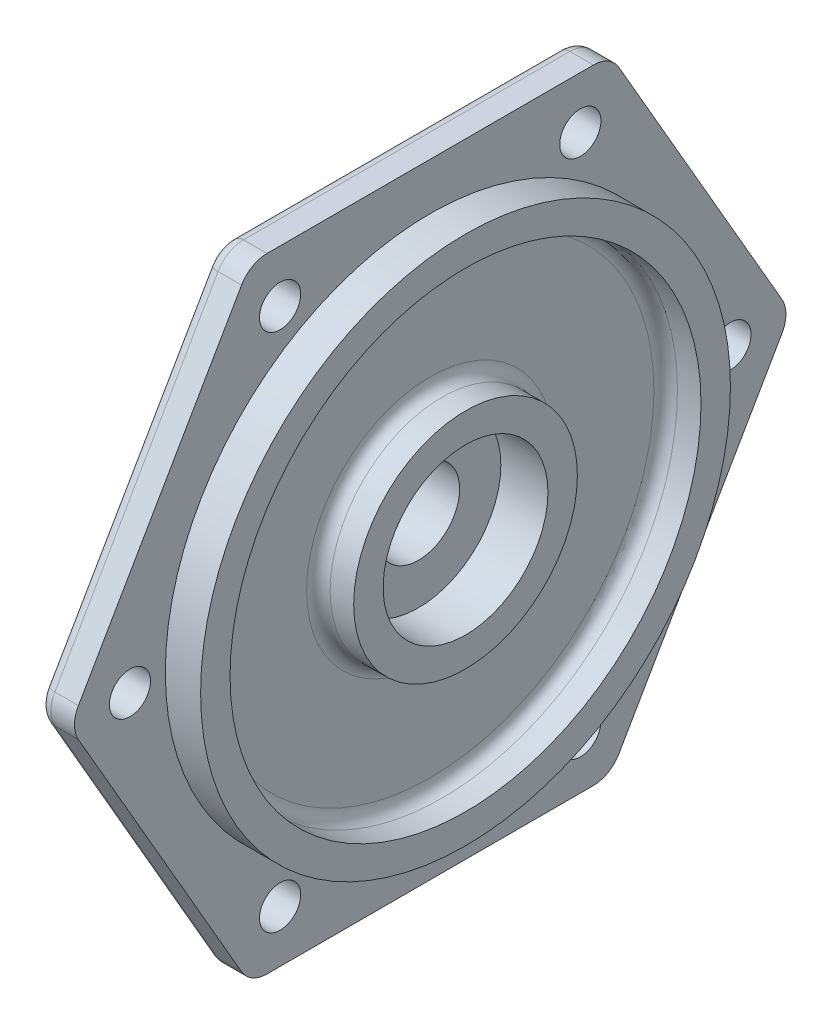
from build123d import *

# Parameters (mm, degrees)
SKETCH1_R               = 3.5
BOSS_EXTRUDE1_DEPTH     = 6
FILLET1_R               = 2
SKETCH2_R               = 45
SKETCH2_R_2             = 40
BOSS_EXTRUDE2_DEPTH     = 6
FILLET2_R               = 2
SKETCH3_R               = 19
SKETCH3_R_2             = 14
BOSS_EXTRUDE3_DEPTH     = 6
FILLET3_R               = 2
CUT_EXTRUDE1_START      = -2
SKETCH4_R               = 14
CUT_EXTRUDE1_DEPTH      = 2
SKETCH6_R               = 23
BOSS_EXTRUDE4_DEPTH     = 4
CUT_EXTRUDE2_DEPTH      = 81.772868331
CUT_EXTRUDE2_DEPTH_BACK = 81.772868331
SKETCH7_R               = 7


with BuildPart() as part:
    # Sketch1 → Boss-Extrude1 (new body)
    with BuildSketch(Plane(origin=(0, 0, 0), x_dir=(0, 0, -1), z_dir=(1, 0, 0))):
        with BuildLine():
            Line((59.755752861, 2.5), (32.04293994, 50.5))
            ThreePointArc((32.04293994, 50.5), (30.212812921, 52.330127019), (27.712812921, 53))
            Line((27.712812921, 53), (-27.712812921, 53))
            ThreePointArc((-27.712812921, 53), (-30.212812921, 52.330127019), (-32.04293994, 50.5))
            Line((-32.04293994, 50.5), (-59.755752861, 2.5))
            ThreePointArc((-59.755752861, 2.5), (-60.425625842, 0), (-59.755752861, -2.5))
            Line((-59.755752861, -2.5), (-32.04293994, -50.5))
            ThreePointArc((-32.04293994, -50.5), (-30.212812921, -52.330127019), (-27.712812921, -53))
            Line((-27.712812921, -53), (27.712812921, -53))
            ThreePointArc((27.712812921, -53), (30.212812921, -52.330127019), (32.04293994, -50.5))
            Line((32.04293994, -50.5), (59.755752861, -2.5))
            ThreePointArc((59.755752861, -2.5), (60.425625842, 0), (59.755752861, 2.5))
        make_face()
        with Locations((-51, 0)):
            Circle(SKETCH1_R, mode=Mode.SUBTRACT)
        with Locations((-25.5, 44.167295593)):
            Circle(SKETCH1_R, mode=Mode.SUBTRACT)
        with Locations((25.5, 44.167295593)):
            Circle(SKETCH1_R, mode=Mode.SUBTRACT)
        with Locations((51, 0)):
            Circle(SKETCH1_R, mode=Mode.SUBTRACT)
        with Locations((25.5, -44.167295593)):
            Circle(SKETCH1_R, mode=Mode.SUBTRACT)
        with Locations((-25.5, -44.167295593)):
            Circle(SKETCH1_R, mode=Mode.SUBTRACT)
    extrude(amount=BOSS_EXTRUDE1_DEPTH)

    # Fillet1
    fillet1_edges = [part.edges().sort_by_distance(p)[0] for p in [
        (0, 26.5, -45.899346401),
        (0, 0, -60.425625842),
        (0, -26.5, -45.899346401),
        (0, -52.330127019, -30.212812921),
        (0, -53, 0),
        (0, -52.330127019, 30.212812921),
        (0, -26.5, 45.899346401),
        (0, 0, 60.425625842),
        (0, 26.5, 45.899346401),
        (0, 52.330127019, 30.212812921),
        (0, 53, 0),
        (0, 52.330127019, -30.212812921),
    ]]
    fillet(fillet1_edges, radius=FILLET1_R)

    # Sketch2 → Boss-Extrude2 (add)
    with BuildSketch(Plane(origin=(6, 0, 0), x_dir=(0, 0, -1), z_dir=(1, 0, 0))):
        with Locations(Location((0, 0, 0), (0, 0, 180))):
            Circle(SKETCH2_R)
        Circle(SKETCH2_R_2, mode=Mode.SUBTRACT)
    extrude(amount=BOSS_EXTRUDE2_DEPTH)

    # Fillet2
    fillet2_edges = [part.edges().sort_by_distance(p)[0] for p in [
        (6, 0, 40),
    ]]
    fillet(fillet2_edges, radius=FILLET2_R)

    # Sketch3 → Boss-Extrude3 (add)
    with BuildSketch(Plane(origin=(6, 0, 0), x_dir=(0, 0, -1), z_dir=(1, 0, 0))):
        with Locations(Location((0, 0, 0), (0, 0, 180))):
            Circle(SKETCH3_R)
        Circle(SKETCH3_R_2, mode=Mode.SUBTRACT)
    extrude(amount=BOSS_EXTRUDE3_DEPTH)

    # Fillet3
    fillet3_edges = [part.edges().sort_by_distance(p)[0] for p in [
        (6, 0, -19),
    ]]
    fillet(fillet3_edges, radius=FILLET3_R)

    # Sketch4 → Cut-Extrude1 (cut)
    with BuildSketch(Plane(origin=(6, 0, 0), x_dir=(0, 0, -1), z_dir=(1, 0, 0)).offset(CUT_EXTRUDE1_START)):
        Circle(SKETCH4_R)
    extrude(amount=CUT_EXTRUDE1_DEPTH, mode=Mode.SUBTRACT)

    # Sketch6 → Boss-Extrude4 (add)
    with BuildSketch(Plane.ZY):
        Circle(SKETCH6_R)
    extrude(amount=BOSS_EXTRUDE4_DEPTH)

    # Sketch7 → Cut-Extrude2 (cut, two sides: drawn at the far end of the back side and taken through both)
    with BuildSketch(Plane(origin=(4, 0, 0), x_dir=(0, 0, -1), z_dir=(1, 0, 0)).offset(-CUT_EXTRUDE2_DEPTH_BACK)):
        Circle(SKETCH7_R)
    extrude(amount=CUT_EXTRUDE2_DEPTH + CUT_EXTRUDE2_DEPTH_BACK, mode=Mode.SUBTRACT)


solid = part.part
